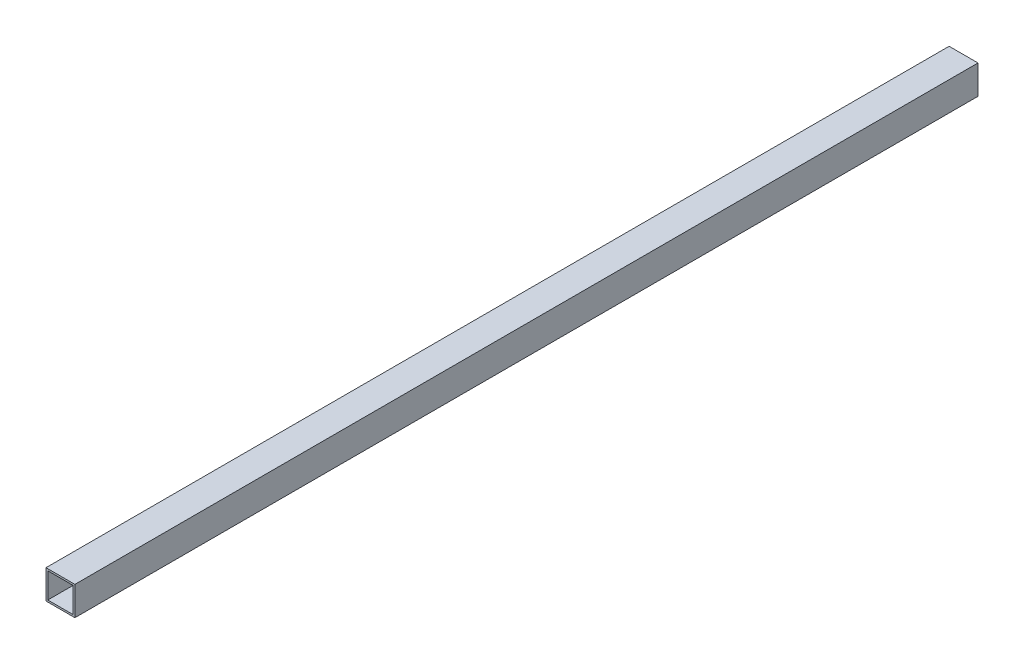
from build123d import *

# Parameters (mm, degrees)
SKETCH2_W           = 8
SKETCH2_H           = 8
SKETCH2_W_2         = 7
SKETCH2_H_2         = 7
BOSS_EXTRUDE1_DEPTH = 250


with BuildPart() as part:
    # Sketch2 → Boss-Extrude1 (new body)
    with BuildSketch(Plane.XY):
        with Locations((4, 4)):
            Rectangle(SKETCH2_W, SKETCH2_H)
        with Locations((4, 4)):
            Rectangle(SKETCH2_W_2, SKETCH2_H_2, mode=Mode.SUBTRACT)
    extrude(amount=BOSS_EXTRUDE1_DEPTH)


solid = part.part
